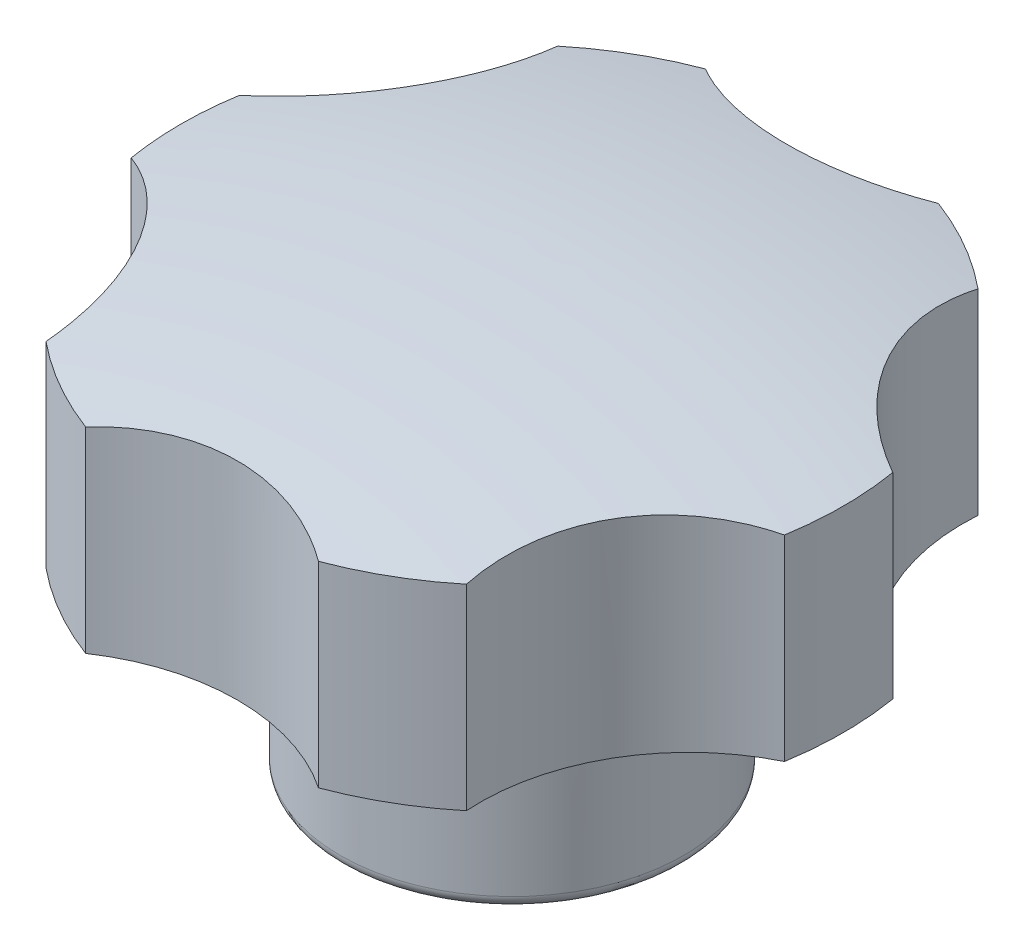
from build123d import *

# Parameters (mm, degrees)
CUT_EXTRUDE_1_DEPTH         = 43.576377572
HOLE_WIZARD_10_0_10_1_D     = 10
HOLE_WIZARD_10_0_10_1_DEPTH = 16.995696905
HOLE_WIZARD_10_0_10_1_TIP   = 3.004303095
FILLET_1_R                  = 1


with BuildPart() as part:
    # 草图1 → 旋转1 (revolve)
    with BuildSketch(Plane.XY, mode=Mode.PRIVATE) as revolve_1_sk:
        with BuildLine():
            Line((0, 0), (-14, 0))
            Line((-14, 0), (-14, 16.165246825))
            Line((-14, 16.165246825), (-27, 16.165246825))
            Line((-27, 16.165246825), (-27, 32.165246825))
            ThreePointArc((-27, 32.165246825), (-13.574201869, 34.289369415), (0, 35))
            Line((0, 35), (0, 0))
        make_face()
    revolve(revolve_1_sk.sketch.rotate(Axis((0, 0, 0), (0, 1, 0)), 270), axis=Axis((0, 0, 0), (0, 1, 0)))

    # 草图2 → 切除-拉伸1 (cut, through all)
    with BuildSketch(Plane.XZ.offset(-16.165246825)):
        with BuildLine():
            ThreePointArc((-26.636693093, 4.414360778), (-19.378362398, 11.188102747), (-17.141295122, 20.860872502))
            ThreePointArc((-17.141295122, 20.860872502), (-23.382685902, 13.5), (-26.636693093, 4.414360778))
        make_face()
        with BuildLine():
            ThreePointArc((9.495397971, 25.27523328), (0, 27), (-9.495397971, 25.27523328))
            ThreePointArc((-9.495397971, 25.27523328), (0, 22.376205494), (9.495397971, 25.27523328))
        make_face()
        with BuildLine():
            ThreePointArc((26.636693093, 4.414360778), (23.382685902, 13.5), (17.141295122, 20.860872502))
            ThreePointArc((17.141295122, 20.860872502), (19.378362398, 11.188102747), (26.636693093, 4.414360778))
        make_face()
        with BuildLine():
            ThreePointArc((17.141295122, -20.860872502), (23.382685902, -13.5), (26.636693093, -4.414360778))
            ThreePointArc((26.636693093, -4.414360778), (19.378362398, -11.188102747), (17.141295122, -20.860872502))
        make_face()
        with BuildLine():
            ThreePointArc((9.495397971, -25.27523328), (0, -22.376205494), (-9.495397971, -25.27523328))
            ThreePointArc((-9.495397971, -25.27523328), (0, -27), (9.495397971, -25.27523328))
        make_face()
        with BuildLine():
            ThreePointArc((-17.141295122, -20.860872502), (-19.378362398, -11.188102747), (-26.636693093, -4.414360778))
            ThreePointArc((-26.636693093, -4.414360778), (-23.382685902, -13.5), (-17.141295122, -20.860872502))
        make_face()
    extrude(amount=-CUT_EXTRUDE_1_DEPTH, mode=Mode.SUBTRACT)

    # Ø10.0 (10) 直径孔1
    with Locations(Plane(origin=(0, 0, 0), x_dir=(-1, 0, 0), z_dir=(0, -1, 0))):
        with Locations((0, 0)):
            Hole(HOLE_WIZARD_10_0_10_1_D / 2, depth=HOLE_WIZARD_10_0_10_1_DEPTH)
            with Locations((0, 0, -(HOLE_WIZARD_10_0_10_1_DEPTH + HOLE_WIZARD_10_0_10_1_TIP / 2))):  # 118° drill point
                Cone(0, HOLE_WIZARD_10_0_10_1_D / 2, HOLE_WIZARD_10_0_10_1_TIP, mode=Mode.SUBTRACT)

    # 圆角1
    fillet_1_edges = [part.edges().sort_by_distance(p)[0] for p in [
        (0, 0, 14),
    ]]
    fillet(fillet_1_edges, radius=FILLET_1_R)


solid = part.part
